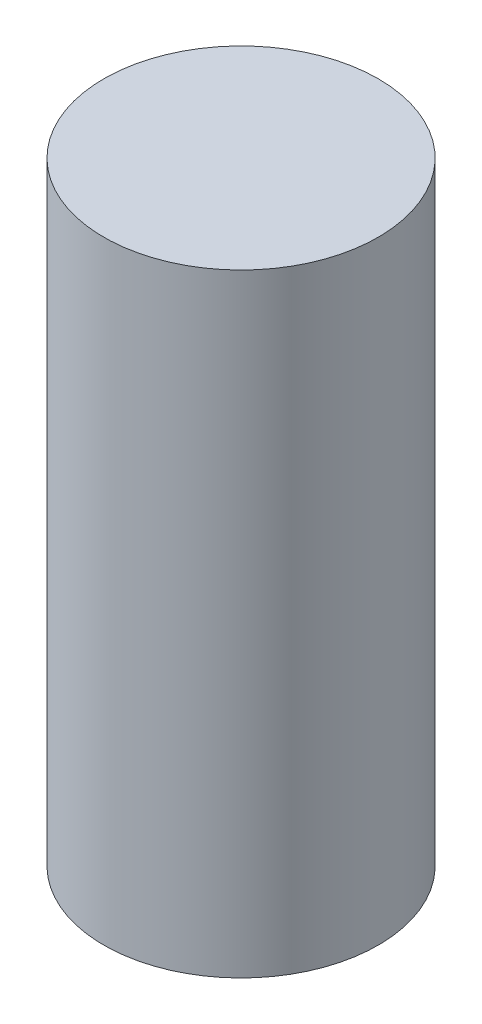
from build123d import *

# Parameters (mm, degrees)
SKETCH1_R           = 1.925
BOSS_EXTRUDE1_DEPTH = 8.6


with BuildPart() as part:
    # Sketch1 → Boss-Extrude1 (new body)
    with BuildSketch(Plane(origin=(0, 0, 0), x_dir=(1, 0, 0), z_dir=(0, 1, 0))):
        with Locations(Location((0, -45.445, 0), (0, 0, 90))):
            Circle(SKETCH1_R)
    extrude(amount=BOSS_EXTRUDE1_DEPTH)


solid = part.part
